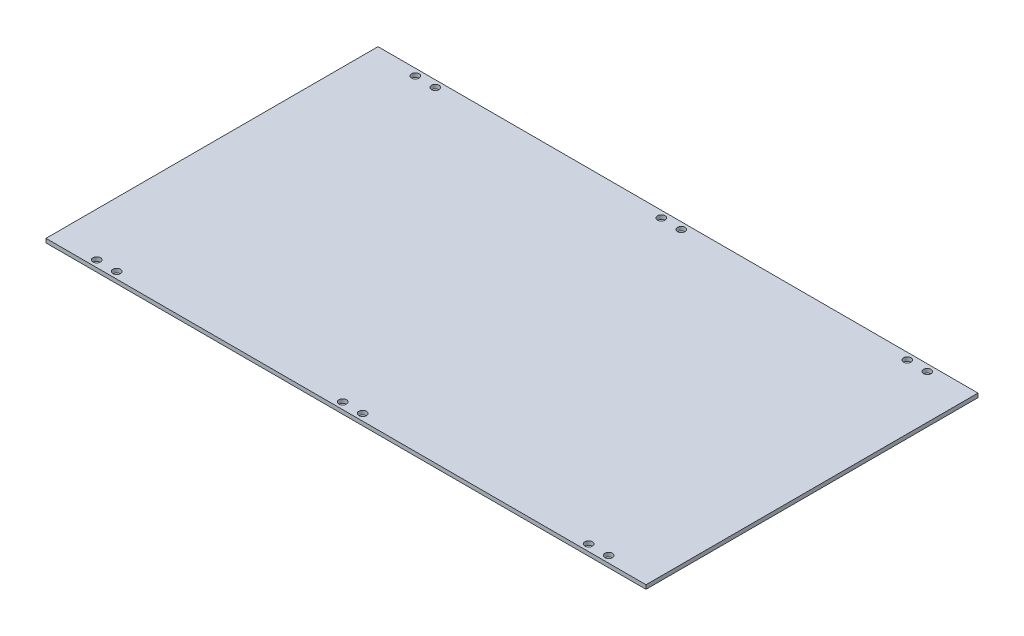
from build123d import *

# Parameters (mm, degrees)
SZKIC3_W                    = 300
SZKIC3_H                    = 166
DODANIE_WYCI_GNI_CIE2_DEPTH = 2
SZKIC4_R                    = 1.9
WYTNIJ_WYCI_GNI_CIE1_DEPTH  = 2


with BuildPart() as part:
    # Szkic3 → Dodanie-wyciągnięcie2 (new body)
    with BuildSketch(Plane(origin=(0, 0, 0), x_dir=(1, 0, 0), z_dir=(0, 1, 0))):
        Rectangle(SZKIC3_W, SZKIC3_H)
    extrude(amount=DODANIE_WYCI_GNI_CIE2_DEPTH)

    # Szkic4 → Wytnij-wyciągnięcie1 (cut)
    with BuildSketch(Plane(origin=(0, 2, 0), x_dir=(1, 0, 0), z_dir=(0, 1, 0))):
        with Locations(Location((128, -79.65, 0), (0, 0, 270))):
            Circle(SZKIC4_R)
        with Locations(Location((118, -79.65, 0), (0, 0, 270))):
            Circle(SZKIC4_R)
        with Locations(Location((118, 79.65, 0), (0, 0, 90))):
            Circle(SZKIC4_R)
        with Locations(Location((128, 79.65, 0), (0, 0, 90))):
            Circle(SZKIC4_R)
        with Locations(Location((-118, -79.65, 0), (0, 0, 90))):
            Circle(SZKIC4_R)
        with Locations(Location((-128, -79.65, 0), (0, 0, 90))):
            Circle(SZKIC4_R)
        with Locations(Location((-128, 79.65, 0), (0, 0, 270))):
            Circle(SZKIC4_R)
        with Locations(Location((-118, 79.65, 0), (0, 0, 270))):
            Circle(SZKIC4_R)
        with Locations(Location((5, -79.65, 0), (0, 0, 270))):
            Circle(SZKIC4_R)
        with Locations(Location((-5, -79.65, 0), (0, 0, 270))):
            Circle(SZKIC4_R)
        with Locations(Location((5, 79.65, 0), (0, 0, 90))):
            Circle(SZKIC4_R)
        with Locations(Location((-5, 79.65, 0), (0, 0, 90))):
            Circle(SZKIC4_R)
    extrude(amount=-WYTNIJ_WYCI_GNI_CIE1_DEPTH, mode=Mode.SUBTRACT)


solid = part.part
